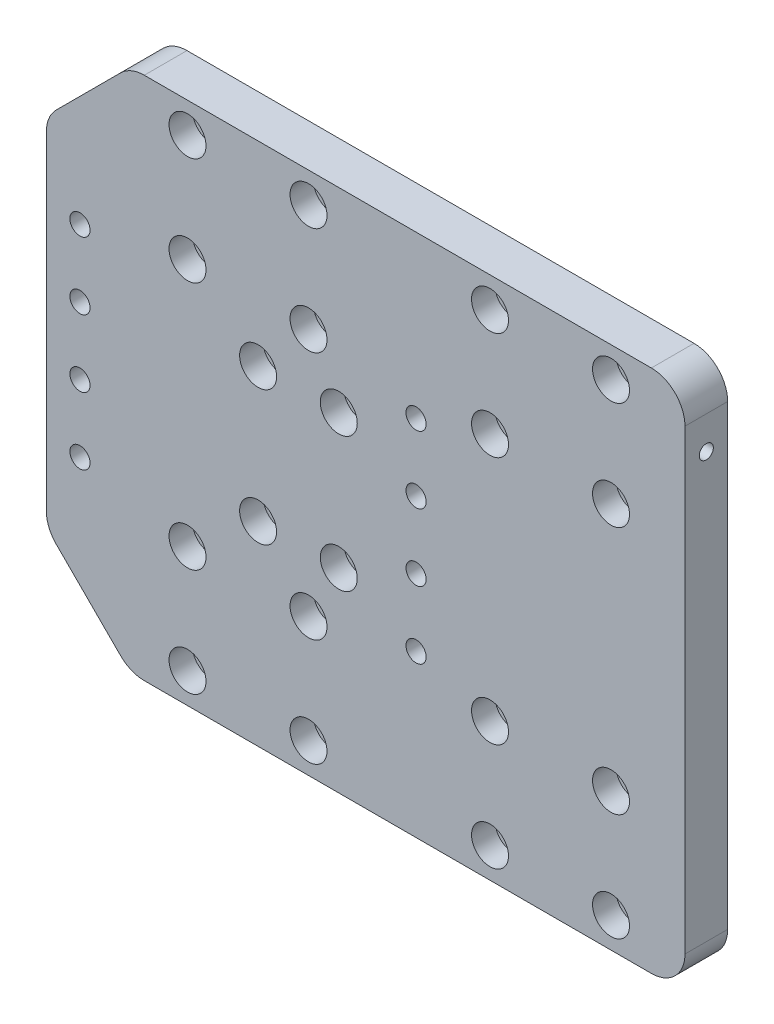
from build123d import *

# Parameters (mm, degrees)
SKETCH1_R                 = 2.5
BOSS_EXTRUDE1_DEPTH       = 12.7
SKETCH2_R                 = 5.5
CUT_EXTRUDE1_DEPTH        = 7
CUT_EXTRUDE2_REACH        = 133.416
SKETCH3_R                 = 3
SKETCH4_R                 = 5.5
CUT_EXTRUDE3_DEPTH        = 7
CHAMFER1_SIZE             = 25
FILLET1_R                 = 10
M5X0_8_TAPPED_HOLE1_D     = 4.2
M5X0_8_TAPPED_HOLE1_DEPTH = 19
M5X0_8_TAPPED_HOLE1_TIP   = 1.2618073


with BuildPart() as part:
    # Sketch1 → Boss-Extrude1 (new body)
    with BuildSketch(Plane.XY):
        Polygon((-85, 78), (85, 78), (85, -78), (-85, -78), (-105, -78), (-105, 78), align=None)
        with Locations((27, -37)):
            Circle(SKETCH1_R, mode=Mode.SUBTRACT)
        with Locations((63, -37)):
            Circle(SKETCH1_R, mode=Mode.SUBTRACT)
        with Locations((27, -69)):
            Circle(SKETCH1_R, mode=Mode.SUBTRACT)
        with Locations((63, -69)):
            Circle(SKETCH1_R, mode=Mode.SUBTRACT)
        with Locations(Location((-63, -37, 0), (0, 0, 180))):
            Circle(SKETCH1_R, mode=Mode.SUBTRACT)
        with Locations(Location((-63, -69, 0), (0, 0, 180))):
            Circle(SKETCH1_R, mode=Mode.SUBTRACT)
        with Locations(Location((-27, -69, 0), (0, 0, 180))):
            Circle(SKETCH1_R, mode=Mode.SUBTRACT)
        with Locations(Location((-27, -37, 0), (0, 0, 180))):
            Circle(SKETCH1_R, mode=Mode.SUBTRACT)
        with Locations(Location((63, 69, 0), (0, 0, 180))):
            Circle(SKETCH1_R, mode=Mode.SUBTRACT)
        with Locations(Location((63, 37, 0), (0, 0, 180))):
            Circle(SKETCH1_R, mode=Mode.SUBTRACT)
        with Locations(Location((27, 69, 0), (0, 0, 180))):
            Circle(SKETCH1_R, mode=Mode.SUBTRACT)
        with Locations(Location((27, 37, 0), (0, 0, 180))):
            Circle(SKETCH1_R, mode=Mode.SUBTRACT)
        with Locations((-27, 69)):
            Circle(SKETCH1_R, mode=Mode.SUBTRACT)
        with Locations((-27, 37)):
            Circle(SKETCH1_R, mode=Mode.SUBTRACT)
        with Locations((-63, 69)):
            Circle(SKETCH1_R, mode=Mode.SUBTRACT)
        with Locations((-63, 37)):
            Circle(SKETCH1_R, mode=Mode.SUBTRACT)
        with Locations((-42, 20)):
            Circle(SKETCH1_R, mode=Mode.SUBTRACT)
        with Locations((-18, 20)):
            Circle(SKETCH1_R, mode=Mode.SUBTRACT)
        with Locations((-42, -20)):
            Circle(SKETCH1_R, mode=Mode.SUBTRACT)
        with Locations((-18, -20)):
            Circle(SKETCH1_R, mode=Mode.SUBTRACT)
    extrude(amount=BOSS_EXTRUDE1_DEPTH)

    # Sketch2 → Cut-Extrude1 (cut)
    with BuildSketch(Plane.XY.offset(12.7)):
        with Locations((-63, 69)):
            Circle(SKETCH2_R)
        with Locations((-27, 69)):
            Circle(SKETCH2_R)
        with Locations((-63, 37)):
            Circle(SKETCH2_R)
        with Locations((-27, 37)):
            Circle(SKETCH2_R)
        with Locations((27, 69)):
            Circle(SKETCH2_R)
        with Locations((63, 69)):
            Circle(SKETCH2_R)
        with Locations((27, 37)):
            Circle(SKETCH2_R)
        with Locations((63, 37)):
            Circle(SKETCH2_R)
        with Locations((-42, 20)):
            Circle(SKETCH2_R)
        with Locations((-18, 20)):
            Circle(SKETCH2_R)
        with Locations((-42, -20)):
            Circle(SKETCH2_R)
        with Locations((-18, -20)):
            Circle(SKETCH2_R)
        with Locations((-63, -37)):
            Circle(SKETCH2_R)
        with Locations((-27, -37)):
            Circle(SKETCH2_R)
        with Locations((-63, -69)):
            Circle(SKETCH2_R)
        with Locations((-27, -69)):
            Circle(SKETCH2_R)
        with Locations((27, -69)):
            Circle(SKETCH2_R)
        with Locations((27, -37)):
            Circle(SKETCH2_R)
        with Locations((63, -37)):
            Circle(SKETCH2_R)
        with Locations((63, -69)):
            Circle(SKETCH2_R)
    extrude(amount=-CUT_EXTRUDE1_DEPTH, mode=Mode.SUBTRACT)

    # Sketch3 → Cut-Extrude2 (cut, up to next)
    with BuildSketch(Plane.XY.offset(12.7), mode=Mode.PRIVATE) as cut_extrude2_sk1:
        with Locations((-95, 30)):
            Circle(SKETCH3_R)
    cut_extrude2_tool1 = extrude(cut_extrude2_sk1.sketch, amount=-CUT_EXTRUDE2_REACH, mode=Mode.PRIVATE) & part.part
    # Sketch3 → Cut-Extrude2 (cut, up to next)
    with BuildSketch(Plane.XY.offset(12.7), mode=Mode.PRIVATE) as cut_extrude2_sk2:
        with Locations((-95, 10)):
            Circle(SKETCH3_R)
    cut_extrude2_tool2 = extrude(cut_extrude2_sk2.sketch, amount=-CUT_EXTRUDE2_REACH, mode=Mode.PRIVATE) & part.part
    # Sketch3 → Cut-Extrude2 (cut, up to next)
    with BuildSketch(Plane.XY.offset(12.7), mode=Mode.PRIVATE) as cut_extrude2_sk3:
        with Locations((-95, -10)):
            Circle(SKETCH3_R)
    cut_extrude2_tool3 = extrude(cut_extrude2_sk3.sketch, amount=-CUT_EXTRUDE2_REACH, mode=Mode.PRIVATE) & part.part
    # Sketch3 → Cut-Extrude2 (cut, up to next)
    with BuildSketch(Plane.XY.offset(12.7), mode=Mode.PRIVATE) as cut_extrude2_sk4:
        with Locations((-95, -30)):
            Circle(SKETCH3_R)
    cut_extrude2_tool4 = extrude(cut_extrude2_sk4.sketch, amount=-CUT_EXTRUDE2_REACH, mode=Mode.PRIVATE) & part.part
    # Sketch3 → Cut-Extrude2 (cut, up to next)
    with BuildSketch(Plane.XY.offset(12.7), mode=Mode.PRIVATE) as cut_extrude2_sk5:
        with Locations((5, -30)):
            Circle(SKETCH3_R)
    cut_extrude2_tool5 = extrude(cut_extrude2_sk5.sketch, amount=-CUT_EXTRUDE2_REACH, mode=Mode.PRIVATE) & part.part
    # Sketch3 → Cut-Extrude2 (cut, up to next)
    with BuildSketch(Plane.XY.offset(12.7), mode=Mode.PRIVATE) as cut_extrude2_sk6:
        with Locations((5, -10)):
            Circle(SKETCH3_R)
    cut_extrude2_tool6 = extrude(cut_extrude2_sk6.sketch, amount=-CUT_EXTRUDE2_REACH, mode=Mode.PRIVATE) & part.part
    # Sketch3 → Cut-Extrude2 (cut, up to next)
    with BuildSketch(Plane.XY.offset(12.7), mode=Mode.PRIVATE) as cut_extrude2_sk7:
        with Locations((5, 10)):
            Circle(SKETCH3_R)
    cut_extrude2_tool7 = extrude(cut_extrude2_sk7.sketch, amount=-CUT_EXTRUDE2_REACH, mode=Mode.PRIVATE) & part.part
    # Sketch3 → Cut-Extrude2 (cut, up to next)
    with BuildSketch(Plane.XY.offset(12.7), mode=Mode.PRIVATE) as cut_extrude2_sk8:
        with Locations((5, 30)):
            Circle(SKETCH3_R)
    cut_extrude2_tool8 = extrude(cut_extrude2_sk8.sketch, amount=-CUT_EXTRUDE2_REACH, mode=Mode.PRIVATE) & part.part
    add(cut_extrude2_tool1.solids().sort_by_distance((-95, 30, 12.7))[0], mode=Mode.SUBTRACT)
    add(cut_extrude2_tool2.solids().sort_by_distance((-95, 10, 12.7))[0], mode=Mode.SUBTRACT)
    add(cut_extrude2_tool3.solids().sort_by_distance((-95, -10, 12.7))[0], mode=Mode.SUBTRACT)
    add(cut_extrude2_tool4.solids().sort_by_distance((-95, -30, 12.7))[0], mode=Mode.SUBTRACT)
    add(cut_extrude2_tool5.solids().sort_by_distance((5, -30, 12.7))[0], mode=Mode.SUBTRACT)
    add(cut_extrude2_tool6.solids().sort_by_distance((5, -10, 12.7))[0], mode=Mode.SUBTRACT)
    add(cut_extrude2_tool7.solids().sort_by_distance((5, 10, 12.7))[0], mode=Mode.SUBTRACT)
    add(cut_extrude2_tool8.solids().sort_by_distance((5, 30, 12.7))[0], mode=Mode.SUBTRACT)

    # Sketch4 → Cut-Extrude3 (cut)
    with BuildSketch(Plane(origin=(0, 0, 0), x_dir=(-1, 0, 0), z_dir=(0, 0, -1))):
        with Locations((-5, 30)):
            Circle(SKETCH4_R)
        with Locations((-5, 10)):
            Circle(SKETCH4_R)
        with Locations((-5, -10)):
            Circle(SKETCH4_R)
        with Locations((-5, -30)):
            Circle(SKETCH4_R)
        with Locations((95, 30)):
            Circle(SKETCH4_R)
        with Locations((95, 10)):
            Circle(SKETCH4_R)
        with Locations((95, -10)):
            Circle(SKETCH4_R)
        with Locations((95, -30)):
            Circle(SKETCH4_R)
    extrude(amount=-CUT_EXTRUDE3_DEPTH, mode=Mode.SUBTRACT)

    # Chamfer1
    chamfer1_edges = [part.edges().sort_by_distance(p)[0] for p in [
        (-105, -78, 6.35),
        (-105, 78, 6.35),
    ]]
    chamfer(chamfer1_edges, length=CHAMFER1_SIZE)

    # Fillet1
    fillet1_edges = [part.edges().sort_by_distance(p)[0] for p in [
        (85, 78, 6.35),
        (85, -78, 6.35),
        (-105, -53, 6.35),
        (-105, 53, 6.35),
        (-80, 78, 6.35),
        (-80, -78, 6.35),
    ]]
    fillet(fillet1_edges, radius=FILLET1_R)

    # M5x0.8 Tapped Hole1
    with Locations(Plane(origin=(85, 0, 0), x_dir=(0, 0, -1), z_dir=(1, 0, 0))):
        with Locations((-6.35, 58.25)):
            Hole(M5X0_8_TAPPED_HOLE1_D / 2, depth=M5X0_8_TAPPED_HOLE1_DEPTH)
            with Locations((0, 0, -(M5X0_8_TAPPED_HOLE1_DEPTH + M5X0_8_TAPPED_HOLE1_TIP / 2))):  # 118° drill point
                Cone(0, M5X0_8_TAPPED_HOLE1_D / 2, M5X0_8_TAPPED_HOLE1_TIP, mode=Mode.SUBTRACT)


solid = part.part
